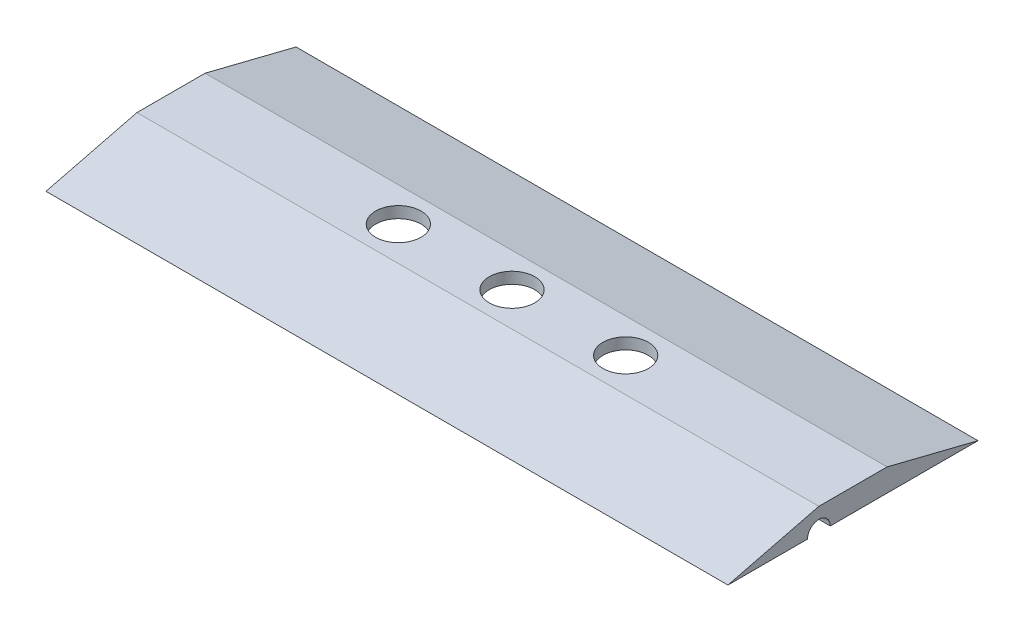
from build123d import *

# Parameters (mm, degrees)
BOSS_EXTRU_1_DEPTH      = 150
ESQUISSE3_R             = 5
ENL_V_MAT_EXTRU_1_DEPTH = 306.163890393
ESQUISSE5_R             = 10
ENL_V_MAT_EXTRU_2_DEPTH = 161.078105936
ESQUISSE6_W             = 150
ESQUISSE6_H             = 30
ESQUISSE6_R             = 2.5
ENL_V_MAT_EXTRU_3_DEPTH = 5


with BuildPart() as part:
    # Esquisse2 → Boss.-Extru.1 (new, symmetric)
    with BuildSketch(Plane(origin=(0, 0, 0), x_dir=(0, 0, -1), z_dir=(1, 0, 0))):
        Polygon((15, 0), (55, 0), (15, 10), (-15, 10), (-55, 0), (-15, 0), align=None)
    extrude(amount=BOSS_EXTRU_1_DEPTH, both=True)

    # Esquisse3 → Enlèv. mat.-Extru.1 (cut, through all)
    with BuildSketch(Plane.ZY.offset(150)):
        with Locations((15, 0)):
            Circle(ESQUISSE3_R)
    extrude(amount=-ENL_V_MAT_EXTRU_1_DEPTH, mode=Mode.SUBTRACT)

    # Esquisse5 → Enlèv. mat.-Extru.2 (cut, through all)
    with BuildSketch(Plane(origin=(0, 10, 0), x_dir=(1, 0, 0), z_dir=(0, 1, 0))):
        with Locations(Location((0, 0, 0), (0, 0, 270))):
            Circle(ESQUISSE5_R)
        with Locations(Location((50, 0, 0), (0, 0, 270))):
            Circle(ESQUISSE5_R)
        with Locations(Location((-50, 0, 0), (0, 0, 270))):
            Circle(ESQUISSE5_R)
    extrude(amount=-ENL_V_MAT_EXTRU_2_DEPTH, mode=Mode.SUBTRACT)

    # Esquisse6 → Enlèv. mat.-Extru.3 (cut)
    with BuildSketch(Plane.XZ):
        Rectangle(ESQUISSE6_W, ESQUISSE6_H)
        with Locations(Location((-66.424308402, 0, 0), (0, 0, 270))):
            Circle(ESQUISSE6_R, mode=Mode.SUBTRACT)
        with Locations(Location((-31.424308402, 0, 0), (0, 0, 270))):
            Circle(ESQUISSE6_R, mode=Mode.SUBTRACT)
        with Locations(Location((-16.424308402, 0, 0), (0, 0, 270))):
            Circle(ESQUISSE6_R, mode=Mode.SUBTRACT)
        with Locations(Location((18.575691598, 0, 0), (0, 0, 270))):
            Circle(ESQUISSE6_R, mode=Mode.SUBTRACT)
        with Locations(Location((33.575691598, 0, 0), (0, 0, 270))):
            Circle(ESQUISSE6_R, mode=Mode.SUBTRACT)
        with Locations(Location((68.575691598, 0, 0), (0, 0, 270))):
            Circle(ESQUISSE6_R, mode=Mode.SUBTRACT)
    extrude(amount=-ENL_V_MAT_EXTRU_3_DEPTH, mode=Mode.SUBTRACT)


solid = part.part
